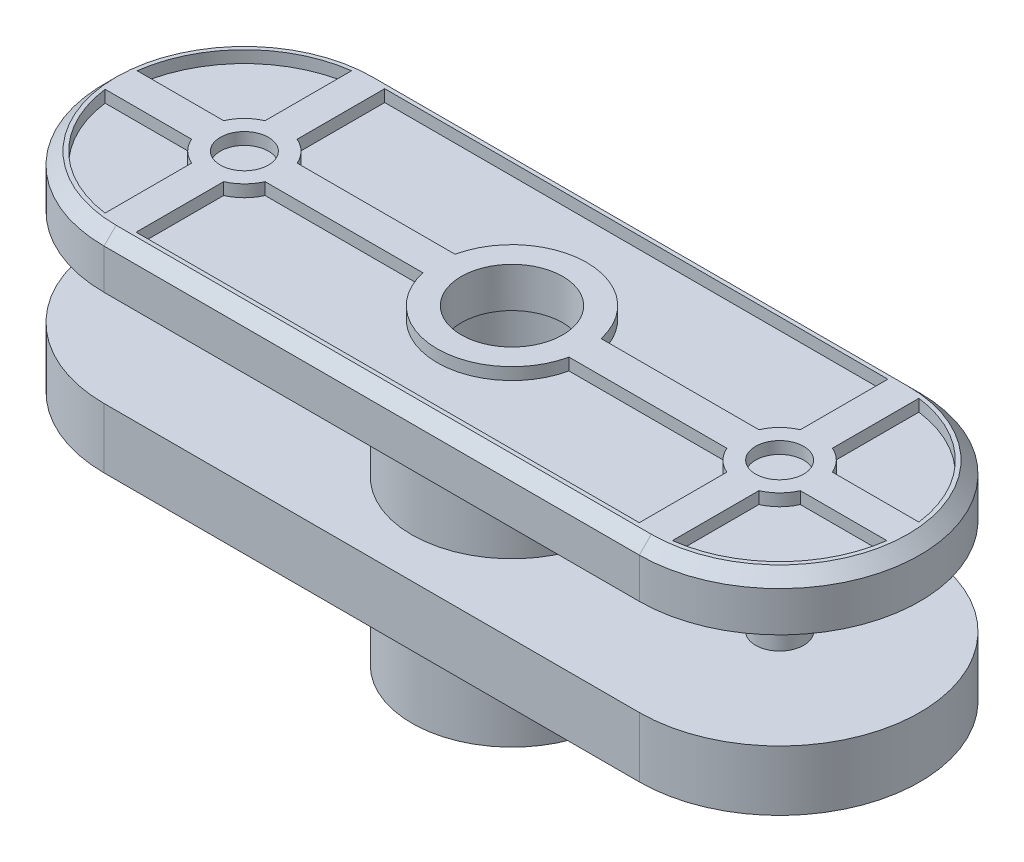
from build123d import *

# Parameters (mm, degrees)
SALIENTE_EXTRUIR1_DEPTH = 1.3
CROQUIS2_R              = 0.6
CORTAR_EXTRUIR1_DEPTH   = 0.3
CHAFL_N1_SIZE           = 0.3
SALIENTE_EXTRUIR2_REACH = 13.047
CROQUIS3_R              = 0.6
CROQUIS3_R_2            = 2.5
SALIENTE_EXTRUIR3_START = -1.2
CROQUIS4_R              = 0.6
CROQUIS4_R_2            = 2.5
SALIENTE_EXTRUIR3_DEPTH = 1.2
SALIENTE_EXTRUIR4_START = 1.5
SALIENTE_EXTRUIR4_DEPTH = 1.5
CROQUIS6_W              = 12.51
CROQUIS6_H              = 2.66
CORTAR_EXTRUIR3_DEPTH   = 0.75
SALIENTE_EXTRUIR5_START = 3.32
CROQUIS8_R              = 2.5
SALIENTE_EXTRUIR5_DEPTH = 3.32
CROQUIS9_R              = 1.65
CORTAR_EXTRUIR4_DEPTH   = 6.77
CROQUIS10_R             = 1.265
CORTAR_EXTRUIR6_DEPTH   = 6.77
CROQUIS12_R             = 1.865
CROQUIS12_R_2           = 1.265
SALIENTE_EXTRUIR6_DEPTH = 0.3


with BuildPart() as part:
    # Croquis1 → Saliente-Extruir1 (new body)
    with BuildSketch(Plane(origin=(0, 0, 0), x_dir=(1, 0, 0), z_dir=(0, 1, 0))):
        with BuildLine():
            Line((-6.675, 3.5), (6.675, 3.5))
            ThreePointArc((6.675, 3.5), (10.175, 0), (6.675, -3.5))
            Line((6.675, -3.5), (-6.675, -3.5))
            ThreePointArc((-6.675, -3.5), (-10.175, 0), (-6.675, 3.5))
        make_face()
    extrude(amount=SALIENTE_EXTRUIR1_DEPTH)

    # Croquis2 → Cortar-Extruir1 (cut)
    with BuildSketch(Plane(origin=(0, 1.3, 0), x_dir=(1, 0, 0), z_dir=(0, 1, 0))):
        with Locations(Location((-6.675, 0, 0), (0, 0, 270))):
            Circle(CROQUIS2_R)
        with Locations(Location((6.675, 0, 0), (0, 0, 90))):
            Circle(CROQUIS2_R)
        with BuildLine():
            Line((-7.075, 3.07408523), (-7.075, 0.916515139))
            ThreePointArc((-7.075, 0.916515139), (-7.382106781, 0.707106781), (-7.591515139, 0.4))
            Line((-7.591515139, 0.4), (-9.74908523, 0.4))
            ThreePointArc((-9.74908523, 0.4), (-8.867031022, 2.192031022), (-7.075, 3.07408523))
        make_face()
        with BuildLine():
            Line((-6.275, 3.1), (-6.275, 0.916515139))
            ThreePointArc((-6.275, 0.916515139), (-5.967893219, 0.707106781), (-5.758484861, 0.4))
            Line((-5.758484861, 0.4), (5.758484861, 0.4))
            ThreePointArc((5.758484861, 0.4), (5.967893219, 0.707106781), (6.275, 0.916515139))
            Line((6.275, 0.916515139), (6.275, 3.1))
            Line((6.275, 3.1), (-6.275, 3.1))
        make_face()
        with BuildLine():
            Line((-6.275, -0.916515139), (-6.275, -3.1))
            Line((-6.275, -3.1), (6.275, -3.1))
            Line((6.275, -3.1), (6.275, -0.916515139))
            ThreePointArc((6.275, -0.916515139), (5.967893219, -0.707106781), (5.758484861, -0.4))
            Line((5.758484861, -0.4), (-5.758484861, -0.4))
            ThreePointArc((-5.758484861, -0.4), (-5.967893219, -0.707106781), (-6.275, -0.916515139))
        make_face()
        with BuildLine():
            Line((-7.591515139, -0.4), (-9.74908523, -0.4))
            ThreePointArc((-9.74908523, -0.4), (-8.867031022, -2.192031022), (-7.075, -3.07408523))
            Line((-7.075, -3.07408523), (-7.075, -0.916515139))
            ThreePointArc((-7.075, -0.916515139), (-7.382106781, -0.707106781), (-7.591515139, -0.4))
        make_face()
        with BuildLine():
            Line((7.075, -0.916515139), (7.075, -3.07408523))
            ThreePointArc((7.075, -3.07408523), (8.867031022, -2.192031022), (9.74908523, -0.4))
            Line((9.74908523, -0.4), (7.591515139, -0.4))
            ThreePointArc((7.591515139, -0.4), (7.382106781, -0.707106781), (7.075, -0.916515139))
        make_face()
        with BuildLine():
            Line((7.591515139, 0.4), (9.74908523, 0.4))
            ThreePointArc((9.74908523, 0.4), (8.867031022, 2.192031022), (7.075, 3.07408523))
            Line((7.075, 3.07408523), (7.075, 0.916515139))
            ThreePointArc((7.075, 0.916515139), (7.382106781, 0.707106781), (7.591515139, 0.4))
        make_face()
    extrude(amount=-CORTAR_EXTRUIR1_DEPTH, mode=Mode.SUBTRACT)

    # Chaflán1
    chafl_n1_edges = [part.edges().sort_by_distance(p)[0] for p in [
        (10.175, 1.3, 0),
        (0, 1.3, -3.5),
        (-10.175, 1.3, 0),
        (0, 1.3, 3.5),
    ]]
    chamfer(chafl_n1_edges, length=CHAFL_N1_SIZE)

    # Croquis3 → Saliente-Extruir2 (add, up to next)
    with BuildSketch(Plane(origin=(0, -1.2, 0), x_dir=(1, 0, 0), z_dir=(0, 1, 0)), mode=Mode.PRIVATE) as saliente_extruir2_sk1:
        with Locations(Location((6.675, 0, 0), (0, 0, 90))):
            Circle(CROQUIS3_R)
    saliente_extruir2_tool1 = extrude(saliente_extruir2_sk1.sketch, amount=SALIENTE_EXTRUIR2_REACH, mode=Mode.PRIVATE) - part.part
    # Croquis3 → Saliente-Extruir2 (add, up to next)
    with BuildSketch(Plane(origin=(0, -1.2, 0), x_dir=(1, 0, 0), z_dir=(0, 1, 0)), mode=Mode.PRIVATE) as saliente_extruir2_sk2:
        with Locations(Location((-6.675, 0, 0), (0, 0, 270))):
            Circle(CROQUIS3_R)
    saliente_extruir2_tool2 = extrude(saliente_extruir2_sk2.sketch, amount=SALIENTE_EXTRUIR2_REACH, mode=Mode.PRIVATE) - part.part
    # Croquis3 → Saliente-Extruir2 (add, up to next)
    with BuildSketch(Plane(origin=(0, -1.2, 0), x_dir=(1, 0, 0), z_dir=(0, 1, 0)), mode=Mode.PRIVATE) as saliente_extruir2_sk3:
        with Locations(Location((0, 0, 0), (0, 0, 270))):
            Circle(CROQUIS3_R_2)
    saliente_extruir2_tool3 = extrude(saliente_extruir2_sk3.sketch, amount=SALIENTE_EXTRUIR2_REACH, mode=Mode.PRIVATE) - part.part
    add(saliente_extruir2_tool1.solids().sort_by_distance((6.675, -1.2, 0))[0])
    add(saliente_extruir2_tool2.solids().sort_by_distance((-6.675, -1.2, 0))[0])
    add(saliente_extruir2_tool3.solids().sort_by_distance((0, -1.2, 0))[0])

    # Croquis4 → Saliente-Extruir3 (add)
    with BuildSketch(Plane(origin=(0, -1.2, 0), x_dir=(1, 0, 0), z_dir=(0, 1, 0)).offset(SALIENTE_EXTRUIR3_START)):
        with Locations(Location((6.675, 0, 0), (0, 0, 90))):
            Circle(CROQUIS4_R)
        with Locations(Location((-6.675, 0, 0), (0, 0, 270))):
            Circle(CROQUIS4_R)
        with Locations(Location((0, 0, 0), (0, 0, 270))):
            Circle(CROQUIS4_R_2)
    extrude(amount=SALIENTE_EXTRUIR3_DEPTH)

    # Croquis5 → Saliente-Extruir4 (add)
    with BuildSketch(Plane.XZ.offset(2.4).offset(SALIENTE_EXTRUIR4_START)):
        with BuildLine():
            Line((6.675, -3.5), (-6.675, -3.5))
            ThreePointArc((-6.675, -3.5), (-10.175, 0), (-6.675, 3.5))
            Line((-6.675, 3.5), (6.675, 3.5))
            ThreePointArc((6.675, 3.5), (10.175, 0), (6.675, -3.5))
        make_face()
    extrude(amount=-SALIENTE_EXTRUIR4_DEPTH)

    # Croquis6 → Cortar-Extruir3 (cut)
    with BuildSketch(Plane.XZ.offset(3.9)):
        with Locations((0, 1.75)):
            Rectangle(CROQUIS6_W, CROQUIS6_H)
        with BuildLine():
            Line((-9.72622926, -0.42), (-7.095, -0.42))
            Line((-7.095, -0.42), (-7.095, -3.05122926))
            ThreePointArc((-7.095, -3.05122926), (-8.852888886, -2.177888886), (-9.72622926, -0.42))
        make_face()
        with Locations((0, -1.75)):
            Rectangle(CROQUIS6_W, CROQUIS6_H)
        with BuildLine():
            Line((7.095, -3.05122926), (7.095, -0.42))
            Line((7.095, -0.42), (9.72622926, -0.42))
            ThreePointArc((9.72622926, -0.42), (8.852888886, -2.177888886), (7.095, -3.05122926))
        make_face()
        with BuildLine():
            Line((-9.72622926, 0.42), (-7.095, 0.42))
            Line((-7.095, 0.42), (-7.095, 3.05122926))
            ThreePointArc((-7.095, 3.05122926), (-8.852888886, 2.177888886), (-9.72622926, 0.42))
        make_face()
        with BuildLine():
            Line((7.095, 0.42), (9.72622926, 0.42))
            ThreePointArc((9.72622926, 0.42), (8.852888886, 2.177888886), (7.095, 3.05122926))
            Line((7.095, 3.05122926), (7.095, 0.42))
        make_face()
    extrude(amount=-CORTAR_EXTRUIR3_DEPTH, mode=Mode.SUBTRACT)

    # Croquis8 → Saliente-Extruir5 (add)
    with BuildSketch(Plane.XZ.offset(3.15).offset(SALIENTE_EXTRUIR5_START)):
        with Locations(Location((0, 0, 0), (0, 0, 90))):
            Circle(CROQUIS8_R)
    extrude(amount=-SALIENTE_EXTRUIR5_DEPTH)

    # Croquis9 → Cortar-Extruir4 (cut)
    with BuildSketch(Plane.XZ.offset(6.47)):
        with Locations(Location((0, 0, 0), (0, 0, 270))):
            Circle(CROQUIS9_R)
    extrude(amount=-CORTAR_EXTRUIR4_DEPTH, mode=Mode.SUBTRACT)

    # Croquis10 → Cortar-Extruir6 (cut)
    with BuildSketch(Plane.XZ.offset(-0.3)):
        with Locations(Location((0, 0, 0), (0, 0, 270))):
            Circle(CROQUIS10_R)
    extrude(amount=-CORTAR_EXTRUIR6_DEPTH, mode=Mode.SUBTRACT)

    # Croquis12 → Saliente-Extruir6 (add)
    with BuildSketch(Plane(origin=(0, 1, 0), x_dir=(1, 0, 0), z_dir=(0, 1, 0))):
        Circle(CROQUIS12_R)
        with Locations(Location((0, 0, 0), (0, 0, 90))):
            Circle(CROQUIS12_R_2, mode=Mode.SUBTRACT)
    extrude(amount=SALIENTE_EXTRUIR6_DEPTH)


solid = part.part
